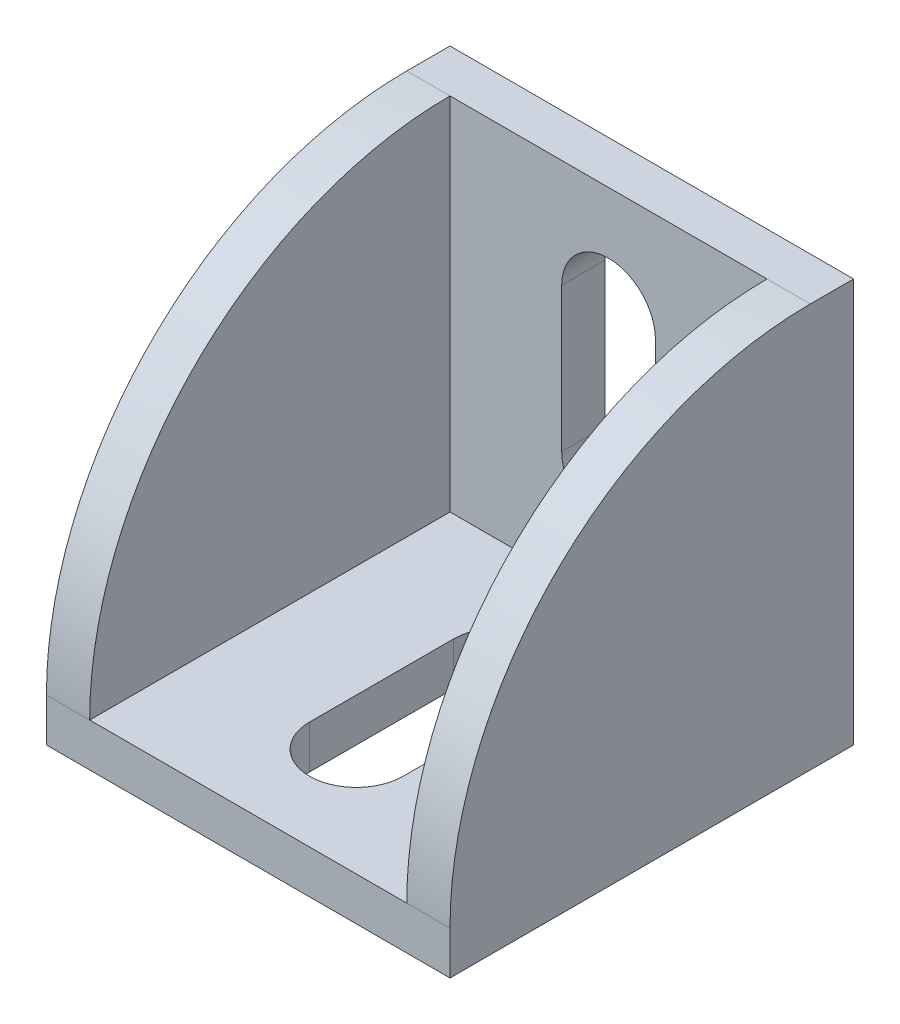
from build123d import *

# Parameters (mm, degrees)
SKETCH1_W           = 28
SKETCH1_H           = 28
BOSS_EXTRUDE1_DEPTH = 3
SKETCH2_W           = 28
SKETCH2_H           = 25
BOSS_EXTRUDE2_DEPTH = 3
BOSS_EXTRUDE3_DEPTH = 3
BOSS_EXTRUDE4_START = -3
BOSS_EXTRUDE4_DEPTH = 3
CUT_EXTRUDE1_DEPTH  = 3
CUT_EXTRUDE2_DEPTH  = 3


with BuildPart() as part:
    # Sketch1 → Boss-Extrude1 (new body)
    with BuildSketch(Plane(origin=(0, 0, 0), x_dir=(1, 0, 0), z_dir=(0, 1, 0))):
        with Locations((14, -14)):
            Rectangle(SKETCH1_W, SKETCH1_H)
    extrude(amount=BOSS_EXTRUDE1_DEPTH)

    # Sketch2 → Boss-Extrude2 (add)
    with BuildSketch(Plane(origin=(0, 0, 0), x_dir=(-1, 0, 0), z_dir=(0, 0, -1))):
        with Locations((-14, 15.5)):
            Rectangle(SKETCH2_W, SKETCH2_H)
    extrude(amount=-BOSS_EXTRUDE2_DEPTH)

    # Sketch3 → Boss-Extrude3 (add)
    with BuildSketch(Plane.ZY):
        with BuildLine():
            Line((3, 28), (3, 3))
            Line((3, 3), (28, 3))
            ThreePointArc((28, 3), (20.67766953, 20.67766953), (3, 28))
        make_face()
    extrude(amount=-BOSS_EXTRUDE3_DEPTH)

    # Sketch4 → Boss-Extrude4 (add)
    with BuildSketch(Plane(origin=(28, 0, 0), x_dir=(0, 0, -1), z_dir=(1, 0, 0)).offset(BOSS_EXTRUDE4_START)):
        with BuildLine():
            Line((-28, 3), (-3, 3))
            Line((-3, 3), (-3, 28))
            ThreePointArc((-3, 28), (-20.67766953, 20.67766953), (-28, 3))
        make_face()
    extrude(amount=BOSS_EXTRUDE4_DEPTH)

    # Sketch5 → Cut-Extrude1 (cut)
    with BuildSketch(Plane.XY.offset(3)):
        with BuildLine():
            Line((10.75, 10.5), (10.75, 20.5))
            ThreePointArc((10.75, 20.5), (14, 23.75), (17.25, 20.5))
            Line((17.25, 20.5), (17.25, 10.5))
            ThreePointArc((17.25, 10.5), (14, 7.25), (10.75, 10.5))
        make_face()
    extrude(amount=-CUT_EXTRUDE1_DEPTH, mode=Mode.SUBTRACT)

    # Sketch6 → Cut-Extrude2 (cut)
    with BuildSketch(Plane(origin=(0, 3, 0), x_dir=(1, 0, 0), z_dir=(0, 1, 0))):
        with BuildLine():
            Line((17.25, -10.5), (17.25, -20.5))
            ThreePointArc((17.25, -20.5), (14, -23.75), (10.75, -20.5))
            Line((10.75, -20.5), (10.75, -10.5))
            ThreePointArc((10.75, -10.5), (14, -7.25), (17.25, -10.5))
        make_face()
    extrude(amount=-CUT_EXTRUDE2_DEPTH, mode=Mode.SUBTRACT)


solid = part.part
